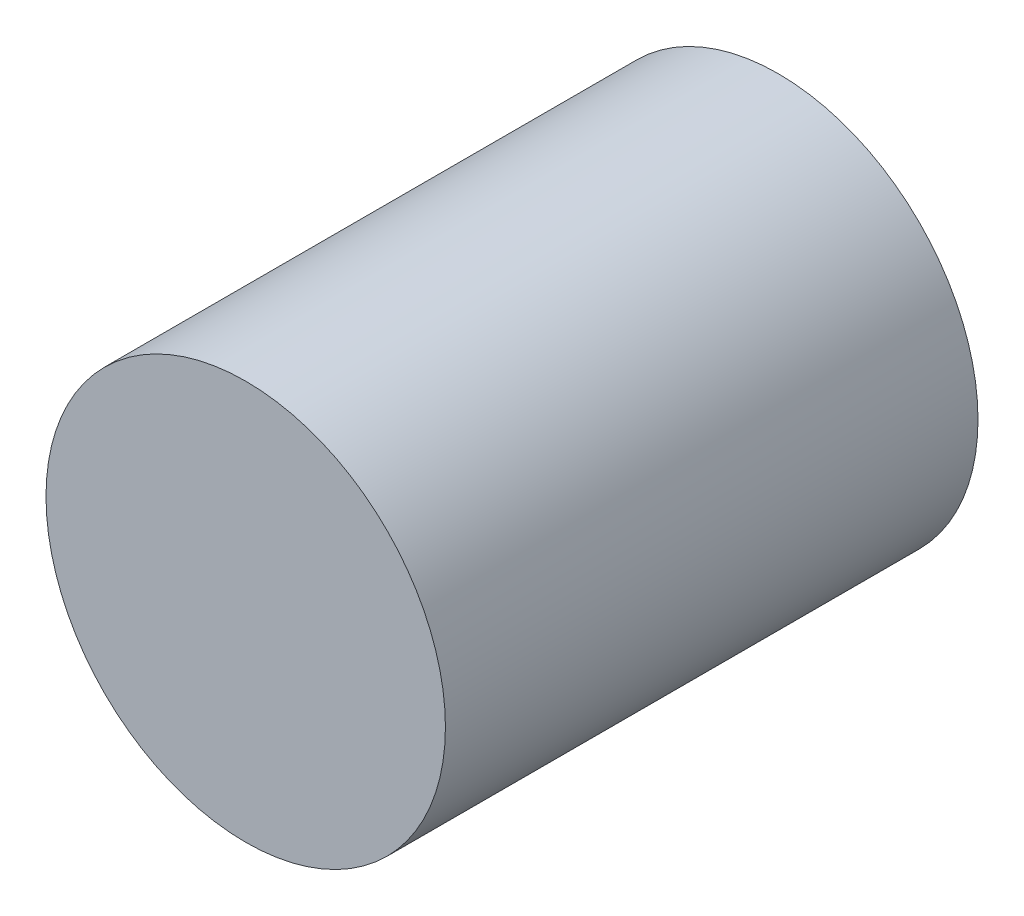
from build123d import *

# Parameters (mm, degrees)
SKETCH1_R      = 9.525
EXTRUDE1_DEPTH = 12.7


with BuildPart() as part:
    # Sketch1 → Extrude1 (new, symmetric)
    with BuildSketch(Plane.XY):
        Circle(SKETCH1_R)
    extrude(amount=EXTRUDE1_DEPTH, both=True)


solid = part.part
